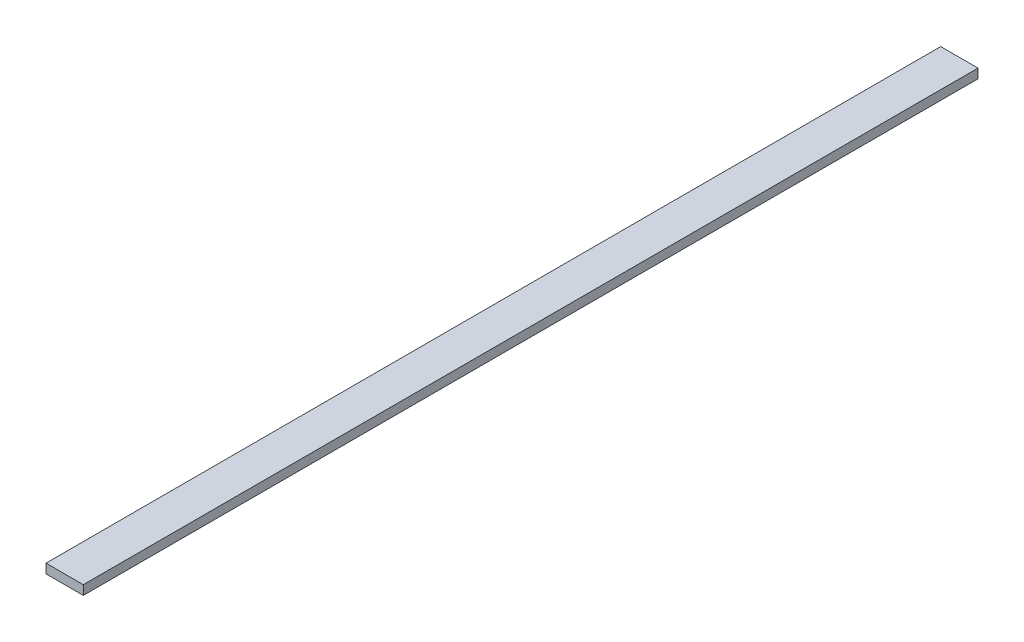
from build123d import *

# Parameters (mm, degrees)
BOSS_EXTRUDE1_DEPTH      = 304.8
BOSS_EXTRUDE1_DEPTH_BACK = 304.8
SKETCH3_W                = 25.4
SKETCH3_H                = 6.35


with BuildPart() as part:
    # Sketch3 → Boss-Extrude1 (new, two sides: drawn at the far end of the back side and taken through both)
    with BuildSketch(Plane.XY.offset(-BOSS_EXTRUDE1_DEPTH_BACK)):
        Rectangle(SKETCH3_W, SKETCH3_H)
    extrude(amount=BOSS_EXTRUDE1_DEPTH + BOSS_EXTRUDE1_DEPTH_BACK)


solid = part.part
